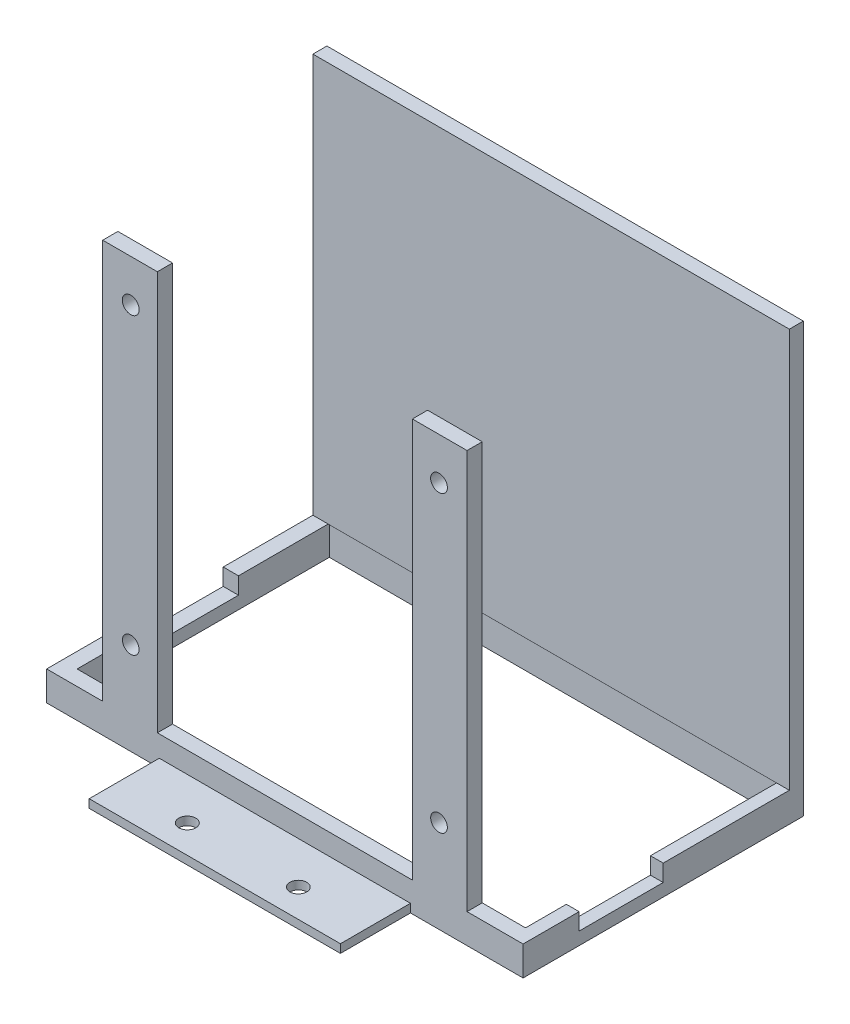
from build123d import *

# Parameters (mm, degrees)
SKETCH2_W                = 170
SKETCH2_H                = 153
BOSS_EXTRUDE2_DEPTH      = 5
BOSS_EXTRUDE3_DEPTH      = 85
BOSS_EXTRUDE3_DEPTH_BACK = 85
SKETCH5_W                = 95
SKETCH5_H                = 10.507653329
SKETCH6_W                = 160
SKETCH6_H                = 90
CUT_EXTRUDE1_DEPTH       = 194.724208244
CUT_EXTRUDE3_DEPTH       = 212.54727604
CUT_EXTRUDE3_DEPTH_BACK  = 6
SKETCH7_W                = 30
SKETCH7_H                = 6
CUT_EXTRUDE4_DEPTH       = 10
CUT_EXTRUDE4_DEPTH_BACK  = 6
SKETCH12_W               = 30
SKETCH12_H               = 6
SKETCH26_W               = 19.5
SKETCH26_H               = 5.419548412
BOSS_EXTRUDE5_DEPTH      = 142.492347
SKETCH27_R               = 2.968954814
SKETCH27_R_2             = 3.008499796
SKETCH27_R_3             = 2.994560416
SKETCH27_R_4             = 2.980489199
CUT_EXTRUDE5_DEPTH       = 10
SKETCH31_W               = 89.634159614
SKETCH31_H               = 3
BOSS_EXTRUDE7_DEPTH      = 25
SKETCH32_R               = 3.023319041
SKETCH32_R_2             = 2.995093442
CUT_EXTRUDE7_DEPTH       = 25
SKETCH34_W               = 90
SKETCH34_H               = 3
BOSS_EXTRUDE8_DEPTH      = 25
SKETCH35_R               = 3.039881536
SKETCH35_R_2             = 2.976011356
CUT_EXTRUDE8_DEPTH       = 213.955394622


with BuildPart() as part:
    # Sketch2 → Boss-Extrude2 (new body)
    with BuildSketch(Plane.XY):
        Rectangle(SKETCH2_W, SKETCH2_H)
    extrude(amount=BOSS_EXTRUDE2_DEPTH)

    # Sketch5 → Boss-Extrude3 (add, two sides: drawn at the far end of the back side and taken through both)
    with BuildSketch(Plane(origin=(0, 0, 0), x_dir=(0, 0, -1), z_dir=(1, 0, 0)).offset(-BOSS_EXTRUDE3_DEPTH_BACK)):
        with Locations((-52.5, -71.246173336)):
            Rectangle(SKETCH5_W, SKETCH5_H)
    extrude(amount=BOSS_EXTRUDE3_DEPTH + BOSS_EXTRUDE3_DEPTH_BACK)

    # Sketch6 → Cut-Extrude1 (cut, through all)
    with BuildSketch(Plane(origin=(0, -65.992346671, 0), x_dir=(1, 0, 0), z_dir=(0, 1, 0))):
        with Locations((0.445660274, -49.580451588)):
            Rectangle(SKETCH6_W, SKETCH6_H)
    extrude(amount=-CUT_EXTRUDE1_DEPTH, mode=Mode.SUBTRACT)

    # Sketch7 → Cut-Extrude3 (cut, two sides: drawn at the far end of the back side and taken through both)
    with BuildSketch(Plane(origin=(85, 0, 0), x_dir=(0, 0, -1), z_dir=(1, 0, 0)).offset(-CUT_EXTRUDE3_DEPTH_BACK)):
        with Locations((-65, -68.992346671)):
            Rectangle(SKETCH7_W, SKETCH7_H)
    extrude(amount=CUT_EXTRUDE3_DEPTH + CUT_EXTRUDE3_DEPTH_BACK, mode=Mode.SUBTRACT)

    # Sketch12 → Cut-Extrude4 (cut, two sides: drawn at the far end of the back side and taken through both)
    with BuildSketch(Plane.ZY.offset(85).offset(-CUT_EXTRUDE4_DEPTH_BACK)):
        with Locations((52, -68.992346671)):
            Rectangle(SKETCH12_W, SKETCH12_H)
    extrude(amount=CUT_EXTRUDE4_DEPTH + CUT_EXTRUDE4_DEPTH_BACK, mode=Mode.SUBTRACT)

    # Sketch26 → Boss-Extrude5 (add, through all)
    with BuildSketch(Plane(origin=(0, -65.992346671, 0), x_dir=(1, 0, 0), z_dir=(0, 1, 0))):
        with Locations((-55.25, -97.290225794)):
            Rectangle(SKETCH26_W, SKETCH26_H)
        with Locations((55.25, -97.290225794)):
            Rectangle(SKETCH26_W, SKETCH26_H)
    extrude(amount=BOSS_EXTRUDE5_DEPTH)

    # Sketch27 → Cut-Extrude5 (cut)
    with BuildSketch(Plane.XY.offset(100)):
        with Locations((-55, -43.5)):
            Circle(SKETCH27_R)
        with Locations((-55, 61.5)):
            Circle(SKETCH27_R_2)
        with Locations((55, 61.5)):
            Circle(SKETCH27_R_3)
        with Locations((55, -43.5)):
            Circle(SKETCH27_R_4)
    extrude(amount=-CUT_EXTRUDE5_DEPTH, mode=Mode.SUBTRACT)

    # Sketch31 → Boss-Extrude7 (add)
    with BuildSketch(Plane.XY.offset(100)):
        with Locations((0, -75)):
            Rectangle(SKETCH31_W, SKETCH31_H)
    extrude(amount=BOSS_EXTRUDE7_DEPTH)

    # Sketch32 → Cut-Extrude7 (cut)
    with BuildSketch(Plane(origin=(0, -73.5, 0), x_dir=(1, 0, 0), z_dir=(0, 1, 0))):
        with Locations(Location((-19.817079807, -115, 0), (0, 0, 270))):
            Circle(SKETCH32_R)
        with Locations(Location((19.817079807, -115, 0), (0, 0, 270))):
            Circle(SKETCH32_R_2)
    extrude(amount=-CUT_EXTRUDE7_DEPTH, mode=Mode.SUBTRACT)

    # Sketch34 → Boss-Extrude8 (add)
    with BuildSketch(Plane(origin=(0, 0, 0), x_dir=(-1, 0, 0), z_dir=(0, 0, -1))):
        with Locations((0, -75)):
            Rectangle(SKETCH34_W, SKETCH34_H)
    extrude(amount=BOSS_EXTRUDE8_DEPTH)

    # Sketch35 → Cut-Extrude8 (cut, through all)
    with BuildSketch(Plane(origin=(0, -73.5, 0), x_dir=(1, 0, 0), z_dir=(0, 1, 0))):
        with Locations(Location((-20, 15, 0), (0, 0, 270))):
            Circle(SKETCH35_R)
        with Locations(Location((22.592886771, 15, 0), (0, 0, 270))):
            Circle(SKETCH35_R_2)
    extrude(amount=-CUT_EXTRUDE8_DEPTH, mode=Mode.SUBTRACT)


solid = part.part
